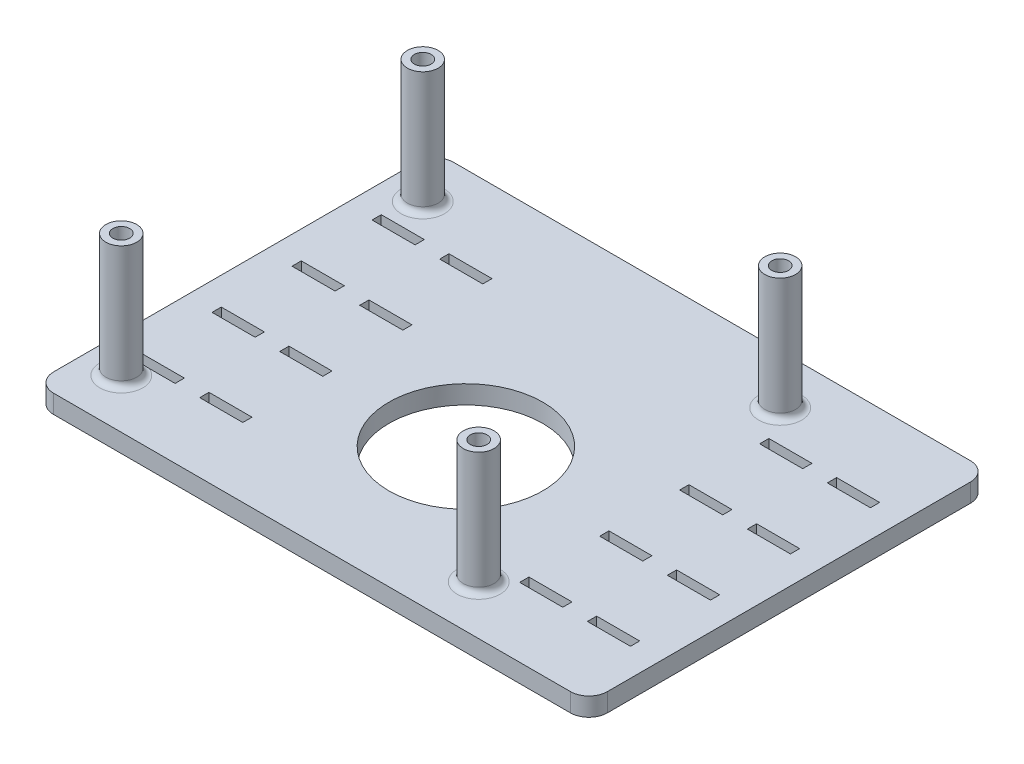
from build123d import *

# Parameters (mm, degrees)
SKIZZE1_W                       = 90
SKIZZE1_H                       = 65
AUFSATZ_LINEAR_AUSTRAGEN1_DEPTH = 3
SKIZZE3_R                       = 2.5
AUFSATZ_LINEAR_AUSTRAGEN2_DEPTH = 20
SKIZZE4_R                       = 1.364499713
SCHNITT_LINEAR_AUSTRAGEN2_DEPTH = 61.085355953
VERRUNDUNG1_R                   = 3
VERRUNDUNG2_R                   = 1
SKIZZE5_R                       = 12.500347999
SCHNITT_LINEAR_AUSTRAGEN3_DEPTH = 61.085355953
SKIZZE6_W                       = 7
SKIZZE6_H                       = 1.5
SCHNITT_LINEAR_AUSTRAGEN4_DEPTH = 61.085355953
LINEARES_MUSTER1_COUNT          = 4
LINEARES_MUSTER1_PITCH          = 13


with BuildPart() as part:
    # Skizze1 → Aufsatz-Linear austragen1 (new body)
    with BuildSketch(Plane(origin=(0, 0, 0), x_dir=(1, 0, 0), z_dir=(0, 1, 0))):
        Rectangle(SKIZZE1_W, SKIZZE1_H)
    extrude(amount=AUFSATZ_LINEAR_AUSTRAGEN1_DEPTH)

    # Skizze3 → Aufsatz-Linear austragen2 (add)
    with BuildSketch(Plane(origin=(0, 3, 0), x_dir=(1, 0, 0), z_dir=(0, 1, 0))):
        with Locations(Location((-39, 24.5, 0), (0, 0, 270))):
            Circle(SKIZZE3_R)
        with Locations(Location((19.085512482, 24.5, 0), (0, 0, 270))):
            Circle(SKIZZE3_R)
        with Locations(Location((19.085512482, -24.5, 0), (0, 0, 270))):
            Circle(SKIZZE3_R)
        with Locations(Location((-39, -24.5, 0), (0, 0, 270))):
            Circle(SKIZZE3_R)
    extrude(amount=AUFSATZ_LINEAR_AUSTRAGEN2_DEPTH)

    # Skizze4 → Schnitt-Linear austragen2 (cut, through all)
    with BuildSketch(Plane(origin=(0, 23, 0), x_dir=(1, 0, 0), z_dir=(0, 1, 0))):
        with Locations(Location((19.085512482, 24.5, 0), (0, 0, 270))):
            Circle(SKIZZE4_R)
        with Locations(Location((-39, 24.5, 0), (0, 0, 270))):
            Circle(SKIZZE4_R)
        with Locations(Location((-39, -24.5, 0), (0, 0, 270))):
            Circle(SKIZZE4_R)
        with Locations(Location((19.085512482, -24.5, 0), (0, 0, 270))):
            Circle(SKIZZE4_R)
    extrude(amount=-SCHNITT_LINEAR_AUSTRAGEN2_DEPTH, mode=Mode.SUBTRACT)

    # Verrundung1
    verrundung1_edges = [part.edges().sort_by_distance(p)[0] for p in [
        (-45, 1.5, 32.5),
        (-45, 1.5, -32.5),
        (45, 1.5, -32.5),
        (45, 1.5, 32.5),
    ]]
    fillet(verrundung1_edges, radius=VERRUNDUNG1_R)

    # Verrundung2
    verrundung2_edges = [part.edges().sort_by_distance(p)[0] for p in [
        (-39, 3, -27),
        (19.085512482, 3, -27),
        (19.085512482, 3, 22),
        (-39, 3, 22),
    ]]
    fillet(verrundung2_edges, radius=VERRUNDUNG2_R)

    # Skizze5 → Schnitt-Linear austragen3 (cut, through all)
    with BuildSketch(Plane.XZ):
        with Locations(Location((-1, 6.5, 0), (0, 0, 270))):
            Circle(SKIZZE5_R)
    extrude(amount=-SCHNITT_LINEAR_AUSTRAGEN3_DEPTH, mode=Mode.SUBTRACT)

    # Skizze6 → Schnitt-Linear austragen4 (cut, through all)
    with BuildSketch(Plane.XZ):
        with Locations((-37, 20.5)):
            Rectangle(SKIZZE6_W, SKIZZE6_H)
        with Locations((-26, 20.5)):
            Rectangle(SKIZZE6_W, SKIZZE6_H)
        with Locations((26, 20.5)):
            Rectangle(SKIZZE6_W, SKIZZE6_H)
        with Locations((37, 20.5)):
            Rectangle(SKIZZE6_W, SKIZZE6_H)
    schnitt_linear_austragen4 = extrude(amount=-SCHNITT_LINEAR_AUSTRAGEN4_DEPTH, mode=Mode.SUBTRACT)

    # Lineares Muster1: Schnitt-Linear austragen4 ×4
    with Locations(*[(0, 0, -i * LINEARES_MUSTER1_PITCH) for i in range(1, LINEARES_MUSTER1_COUNT)]):
        add(schnitt_linear_austragen4, mode=Mode.SUBTRACT)


solid = part.part
